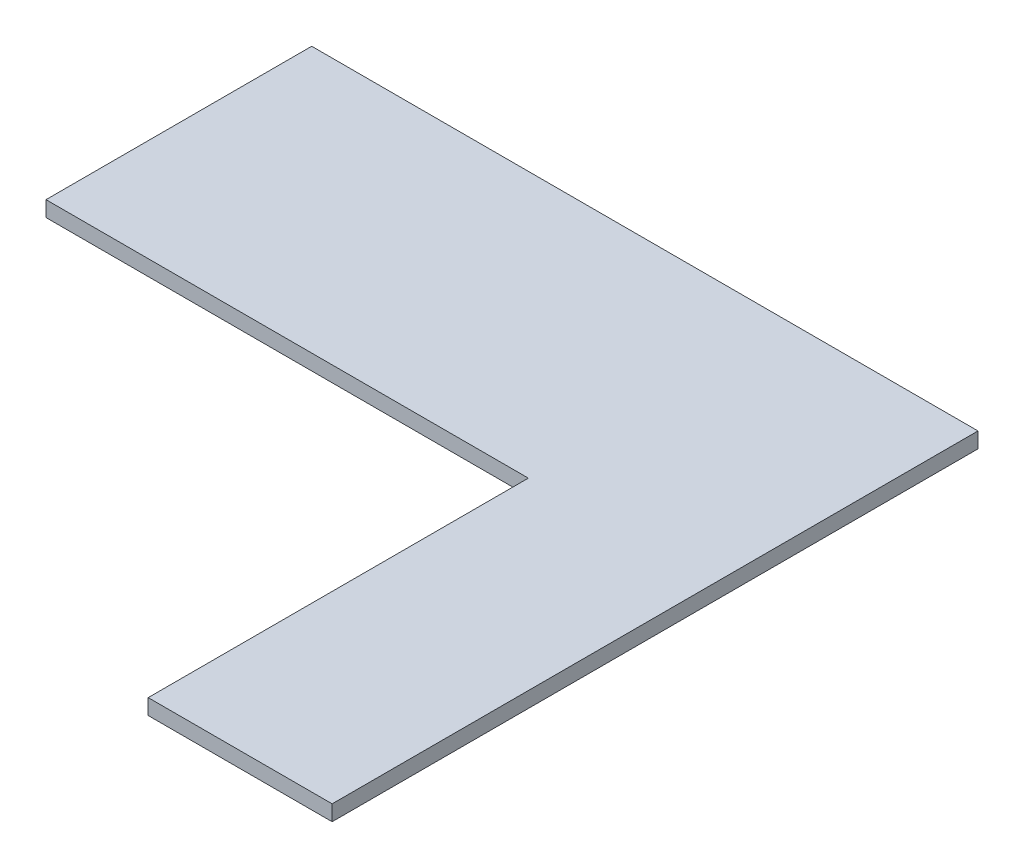
from build123d import *

# Parameters (mm, degrees)
EXTRUDE_1_DEPTH = 38


with BuildPart() as part:
    # Эскиз1 → Бобышка-Вытянуть1 (new body)
    with BuildSketch(Plane(origin=(0, 0, 0), x_dir=(1, 0, 0), z_dir=(0, 1, 0))):
        Polygon((0, 0), (0, 650), (1630, 650), (1630, -930), (1180, -930), (1180, 0), align=None)
    extrude(amount=EXTRUDE_1_DEPTH)


solid = part.part
